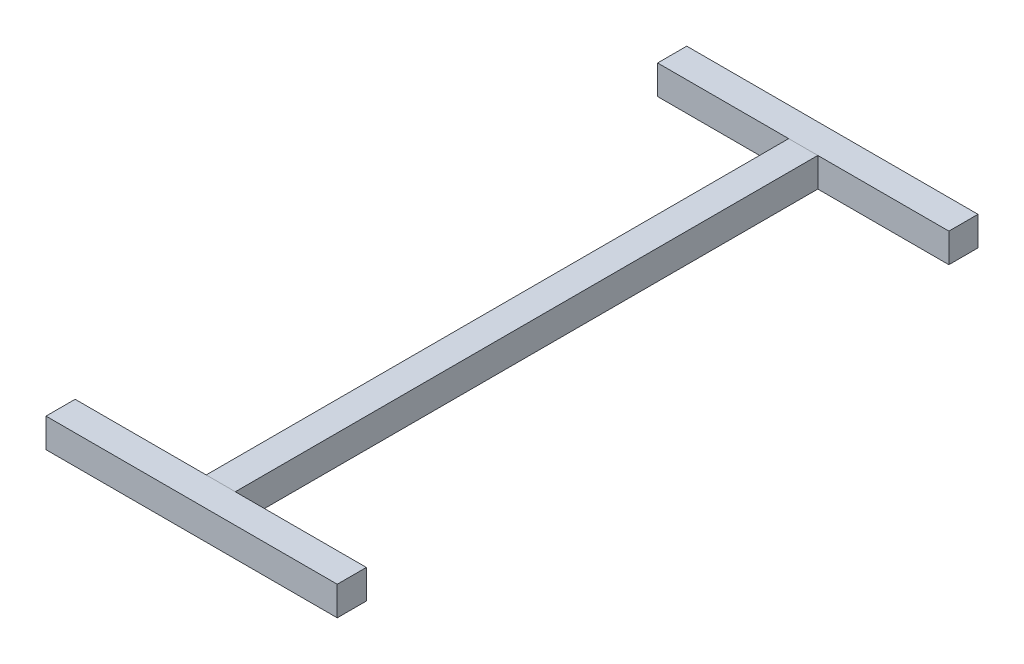
from build123d import *

# Parameters (mm, degrees)
SKETCH_1_W      = 20
SKETCH_1_H      = 20
EXTRUDE_1_DEPTH = 200
SKETCH_2_W      = 20
SKETCH_2_H      = 20
EXTRUDE_2_DEPTH = 100


with BuildPart() as part:
    # Эскиз1 → Бобышка-Вытянуть1 (new, symmetric)
    with BuildSketch(Plane.XY):
        Rectangle(SKETCH_1_W, SKETCH_1_H)
    extrude(amount=EXTRUDE_1_DEPTH, both=True)


with BuildPart() as body_2:
    # Эскиз2 → Бобышка-Вытянуть2 (new, symmetric)
    with BuildSketch(Plane(origin=(0, 0, 0), x_dir=(0, 0, -1), z_dir=(1, 0, 0))):
        with Locations((210, 0)):
            Rectangle(SKETCH_2_W, SKETCH_2_H)
    extrude(amount=EXTRUDE_2_DEPTH, both=True)


with BuildPart() as body_3:
    # Зеркальное отражение1: mirrored copy
    add(body_2.part.mirror(Plane.XY))


solid = Compound([part.part, body_2.part, body_3.part])
